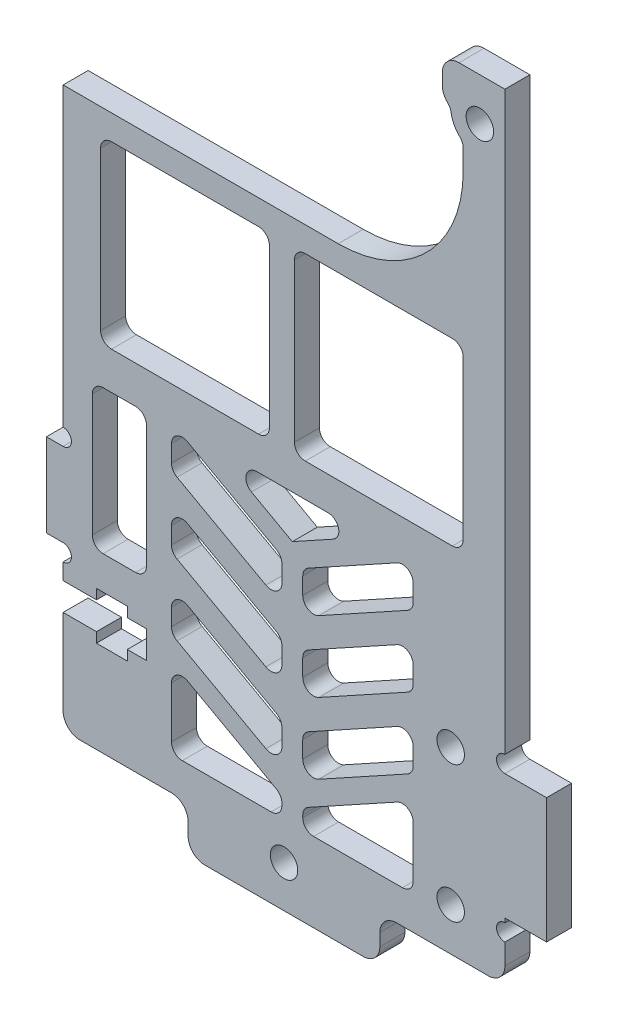
from build123d import *

# Parameters (mm, degrees)
SKETCH_1_W           = 53
SKETCH_1_H           = 150
EXTRUDE_1_DEPTH      = 3
SKETCH_11_R          = 1.65
CUT_EXTRUDE_6_DEPTH  = 10
SKETCH_12_R          = 1.65
CUT_EXTRUDE_7_DEPTH  = 10
SKETCH_13_R          = 1.65
CUT_EXTRUDE_8_DEPTH  = 10
SKETCH_14_W          = 53
SKETCH_14_H          = 15
EXTRUDE_2_DEPTH      = 3
CUT_EXTRUDE_9_DEPTH  = 10
SKETCH_22_W          = 6
SKETCH_22_H          = 35.885928423
CUT_EXTRUDE_10_DEPTH = 10
SKETCH_23_W          = 10
SKETCH_23_H          = 15
EXTRUDE_3_DEPTH      = 3
SKETCH_25_R          = 1.65
CUT_EXTRUDE_12_DEPTH = 10
SKETCH_26_W          = 4
SKETCH_26_H          = 10
EXTRUDE_4_DEPTH      = 3
SKETCH_27_R          = 1
CUT_EXTRUDE_13_DEPTH = 10
SKETCH_28_W          = 3.3
SKETCH_28_H          = 3.3
CUT_EXTRUDE_14_DEPTH = 10
SKETCH_29_W          = 3.7
SKETCH_29_H          = 5.7
CUT_EXTRUDE_15_DEPTH = 10
SKETCH_30_W          = 13.25
SKETCH_30_H          = 22.6
SKETCH_30_W_2        = 20.25
SKETCH_30_H_2        = 21.557035789
SKETCH_30_H_3        = 21.557035788
SKETCH_30_H_4        = 9.4
CUT_EXTRUDE_16_DEPTH = 10
SKETCH_31_W          = 15
SKETCH_31_H          = 5.5
CUT_EXTRUDE_17_DEPTH = 10
SKETCH_32_W          = 6.5
SKETCH_32_H          = 17.25
CUT_EXTRUDE_18_DEPTH = 10
FILLET_1_R           = 1.3
FILLET_2_R           = 2
SKETCH_33_W          = 29.5
SKETCH_33_H          = 35
EXTRUDE_5_DEPTH      = 3
CUT_EXTRUDE_19_DEPTH = 10
SKETCH_35_W          = 2.5
SKETCH_35_H          = 22.689655172
EXTRUDE_6_DEPTH      = 3
FILLET_3_R           = 1.3
SKETCH_37_R          = 1.65
EXTRUDE_7_DEPTH      = 3
FILLET_4_R           = 1.3
SKETCH_38_W          = 6
SKETCH_38_H          = 19.885928423
CUT_EXTRUDE_20_DEPTH = 82.401781307
SKETCH_39_W          = 61
SKETCH_39_H          = 26.057035788
CUT_EXTRUDE_21_DEPTH = 82.401781307
FILLET_6_R           = 2
FILLET_7_R           = 15
SKETCH_40_R          = 1
CUT_EXTRUDE_22_DEPTH = 82.401781307


with BuildPart() as part:
    # 草图1 → 凸台-拉伸1 (new body)
    with BuildSketch(Plane.XY):
        Rectangle(SKETCH_1_W, SKETCH_1_H)
    extrude(amount=EXTRUDE_1_DEPTH)

    # 草图11 → 切除-拉伸6 (cut)
    with BuildSketch(Plane.XY.offset(3)):
        with Locations((0, -70)):
            Circle(SKETCH_11_R)
    extrude(amount=-CUT_EXTRUDE_6_DEPTH, mode=Mode.SUBTRACT)

    # 草图12 → 切除-拉伸7 (cut)
    with BuildSketch(Plane.XY.offset(3)):
        with Locations((-23.5, 54.5)):
            Circle(SKETCH_12_R)
        with Locations((-23.5, 34.5)):
            Circle(SKETCH_12_R)
    extrude(amount=-CUT_EXTRUDE_7_DEPTH, mode=Mode.SUBTRACT)

    # 草图13 → 切除-拉伸8 (cut)
    with BuildSketch(Plane(origin=(0, 0, 0), x_dir=(-1, 0, 0), z_dir=(0, 0, -1))):
        with Locations((-23.5, 18.5)):
            Circle(SKETCH_13_R)
        with Locations((-23.5, 38.5)):
            Circle(SKETCH_13_R)
    extrude(amount=-CUT_EXTRUDE_8_DEPTH, mode=Mode.SUBTRACT)

    # 草图14 → 凸台-拉伸2 (add)
    with BuildSketch(Plane(origin=(0, 0, 0), x_dir=(-1, 0, 0), z_dir=(0, 0, -1))):
        with Locations((0, 82.5)):
            Rectangle(SKETCH_14_W, SKETCH_14_H)
    extrude(amount=-EXTRUDE_2_DEPTH)

    # 草图21 → 切除-拉伸9 (cut)
    with BuildSketch(Plane(origin=(0, 0, 0), x_dir=(-1, 0, 0), z_dir=(0, 0, -1))):
        Polygon((-26.5, 43.5), (-20.5, 43.5), (-20.5, 23.614071577), (20.5, 23.614071577), (20.5, 59.5), (26.5, 59.5), (26.5, 90), (-26.5, 90), align=None)
    extrude(amount=-CUT_EXTRUDE_9_DEPTH, mode=Mode.SUBTRACT)

    # 草图22 → 切除-拉伸10 (cut)
    with BuildSketch(Plane(origin=(0, 0, 0), x_dir=(-1, 0, 0), z_dir=(0, 0, -1))):
        with Locations((23.5, 41.557035789)):
            Rectangle(SKETCH_22_W, SKETCH_22_H)
    extrude(amount=-CUT_EXTRUDE_10_DEPTH, mode=Mode.SUBTRACT)

    # 草图23 → 凸台-拉伸3 (add)
    with BuildSketch(Plane(origin=(0, 0, 0), x_dir=(-1, 0, 0), z_dir=(0, 0, -1))):
        with Locations((-26.5, -55)):
            Rectangle(SKETCH_23_W, SKETCH_23_H)
    extrude(amount=-EXTRUDE_3_DEPTH)

    # 草图25 → 切除-拉伸12 (cut)
    with BuildSketch(Plane(origin=(0, 0, 0), x_dir=(-1, 0, 0), z_dir=(0, 0, -1))):
        with Locations((-20, -48)):
            Circle(SKETCH_25_R)
        with Locations((-20, -64.364049227)):
            Circle(SKETCH_25_R)
    extrude(amount=-CUT_EXTRUDE_12_DEPTH, mode=Mode.SUBTRACT)

    # 草图26 → 凸台-拉伸4 (add)
    with BuildSketch(Plane.XY.offset(3)):
        with Locations((-26.5, -45)):
            Rectangle(SKETCH_26_W, SKETCH_26_H)
    extrude(amount=-EXTRUDE_4_DEPTH)

    # 草图27 → 切除-拉伸13 (cut)
    with BuildSketch(Plane.XY.offset(3)):
        with Locations((-26.5, -39)):
            Circle(SKETCH_27_R)
        with Locations((-26.5, -51)):
            Circle(SKETCH_27_R)
    extrude(amount=-CUT_EXTRUDE_13_DEPTH, mode=Mode.SUBTRACT)

    # 草图28 → 切除-拉伸14 (cut)
    with BuildSketch(Plane.ZY.offset(26.5)):
        with Locations((1.5173157, -55.6)):
            Rectangle(SKETCH_28_W, SKETCH_28_H)
    extrude(amount=-CUT_EXTRUDE_14_DEPTH, mode=Mode.SUBTRACT)

    # 草图29 → 切除-拉伸15 (cut)
    with BuildSketch(Plane(origin=(0, 0, 0), x_dir=(-1, 0, 0), z_dir=(0, 0, -1))):
        with Locations((20.65, -55.6)):
            Rectangle(SKETCH_29_W, SKETCH_29_H)
    extrude(amount=-CUT_EXTRUDE_15_DEPTH, mode=Mode.SUBTRACT)

    # 草图30 → 切除-拉伸16 (cut)
    with BuildSketch(Plane(origin=(0, 0, 0), x_dir=(-1, 0, 0), z_dir=(0, 0, -1))):
        with Locations((6.375, -42.8)):
            Rectangle(SKETCH_30_W, SKETCH_30_H)
        with Locations((-9.875, -42.8)):
            Rectangle(SKETCH_30_W, SKETCH_30_H)
        with Locations((-11.375, -16.221482106)):
            Rectangle(SKETCH_30_W_2, SKETCH_30_H_2)
        with Locations((-11.375, 8.335553683)):
            Rectangle(SKETCH_30_W_2, SKETCH_30_H_3)
        with Locations((11.875, 8.335553683)):
            Rectangle(SKETCH_30_W_2, SKETCH_30_H_3)
        with Locations((11.875, -16.221482106)):
            Rectangle(SKETCH_30_W_2, SKETCH_30_H_2)
        with Locations((-9.875, -61.8)):
            Rectangle(SKETCH_30_W, SKETCH_30_H_4)
        with Locations((6.375, -61.8)):
            Rectangle(SKETCH_30_W, SKETCH_30_H_4)
    extrude(amount=-CUT_EXTRUDE_16_DEPTH, mode=Mode.SUBTRACT)

    # 草图31 → 切除-拉伸17 (cut)
    with BuildSketch(Plane(origin=(0, 0, 0), x_dir=(-1, 0, 0), z_dir=(0, 0, -1))):
        with Locations((-19, -72.25)):
            Rectangle(SKETCH_31_W, SKETCH_31_H)
        with Locations((19, -72.25)):
            Rectangle(SKETCH_31_W, SKETCH_31_H)
    extrude(amount=-CUT_EXTRUDE_17_DEPTH, mode=Mode.SUBTRACT)

    # 草图32 → 切除-拉伸18 (cut)
    with BuildSketch(Plane(origin=(0, 0, 0), x_dir=(-1, 0, 0), z_dir=(0, 0, -1))):
        with Locations((19.75, -40.125)):
            Rectangle(SKETCH_32_W, SKETCH_32_H)
    extrude(amount=-CUT_EXTRUDE_18_DEPTH, mode=Mode.SUBTRACT)

    # 圆角1
    fillet_1_edges = [part.edges().sort_by_distance(p)[0] for p in [
        (3.25, -54.1, 1.5),
        (16.5, -54.1, 1.5),
        (16.5, -31.5, 1.5),
        (3.25, -31.5, 1.5),
        (21.5, -5.442964211, 1.5),
        (1.25, -5.442964211, 1.5),
        (1.25, -27, 1.5),
        (21.5, -27, 1.5),
        (1.25, 19.114071577, 1.5),
        (1.25, -2.442964211, 1.5),
        (-1.75, -2.442964211, 1.5),
        (-1.75, 19.114071577, 1.5),
        (-22, 19.114071577, 1.5),
        (-22, -2.442964211, 1.5),
        (-13, -57.1, 1.5),
        (-13, -66.5, 1.5),
        (0.25, -66.5, 1.5),
        (0.25, -57.1, 1.5),
        (3.25, -57.1, 1.5),
        (3.25, -66.5, 1.5),
        (16.5, -66.5, 1.5),
        (16.5, -57.1, 1.5),
        (-1.75, -5.442964211, 1.5),
        (-22, -5.442964211, 1.5),
        (-22, -27, 1.5),
        (-1.75, -27, 1.5),
        (-13, -54.1, 1.5),
        (0.25, -54.1, 1.5),
        (0.25, -31.5, 1.5),
        (-13, -31.5, 1.5),
        (-16.5, -48.75, 1.5),
        (-16.5, -31.5, 1.5),
        (-23, -31.5, 1.5),
        (-23, -48.75, 1.5),
    ]]
    fillet(fillet_1_edges, radius=FILLET_1_R)

    # 圆角2
    fillet_2_edges = [part.edges().sort_by_distance(p)[0] for p in [
        (-26.5, 23.614071577, 1.5),
        (-11.5, -75, 1.5),
        (11.5, -75, 1.5),
        (26.5, -69.5, 1.5),
        (11.5, -69.5, 1.5),
        (-11.5, -69.5, 1.5),
        (-26.5, -69.5, 1.5),
    ]]
    fillet(fillet_2_edges, radius=FILLET_2_R)

    # 草图33 → 凸台-拉伸5 (add)
    with BuildSketch(Plane(origin=(0, 0, 0), x_dir=(-1, 0, 0), z_dir=(0, 0, -1))):
        with Locations((-1.75, -49)):
            Rectangle(SKETCH_33_W, SKETCH_33_H)
    extrude(amount=-EXTRUDE_5_DEPTH)

    # 草图34 → 切除-拉伸19 (cut)
    with BuildSketch(Plane(origin=(0, 0, 0), x_dir=(-1, 0, 0), z_dir=(0, 0, -1))):
        Polygon((-15.5, -31), (-1, -39), (13.5, -31), (13.5, -36), (-1, -44), (-15.5, -36), align=None)
        Polygon((-15.5, -44.5), (-15.5, -39.5), (-1, -47.5), (13.5, -39.5), (13.5, -44.5), (-1, -52.5), align=None)
        Polygon((-15.5, -53), (-15.5, -48), (-1, -56), (13.5, -48), (13.5, -53), (-1, -61), align=None)
        Polygon((-2.25, -65.5), (-2.25, -63.165602614), (-15.5, -55.855257786), (-15.5, -65.5), align=None)
        Polygon((13.5, -55.855257786), (13.5, -65.5), (0.25, -65.5), (0.25, -63.165602614), align=None)
        Polygon((8.324845262, -31), (-1, -36.144742214), (-10.324845262, -31), align=None)
    extrude(amount=-CUT_EXTRUDE_19_DEPTH, mode=Mode.SUBTRACT)

    # 草图35 → 凸台-拉伸6 (add)
    with BuildSketch(Plane(origin=(0, 0, 0), x_dir=(-1, 0, 0), z_dir=(0, 0, -1))):
        with Locations((-1, -49.655172414)):
            Rectangle(SKETCH_35_W, SKETCH_35_H)
    extrude(amount=-EXTRUDE_6_DEPTH)

    # 圆角3
    fillet_3_edges = [part.edges().sort_by_distance(p)[0] for p in [
        (2.25, -60.310344828, 1.5),
        (-0.25, -60.310344828, 1.5),
        (-0.25, -38.310344828, 1.5),
        (-0.25, -43.310344828, 1.5),
        (-0.25, -46.810344828, 1.5),
        (-0.25, -51.810344828, 1.5),
        (-0.25, -55.310344828, 1.5),
        (2.25, -43.310344828, 1.5),
        (2.25, -46.810344828, 1.5),
        (2.25, -51.810344828, 1.5),
        (2.25, -55.310344828, 1.5),
        (2.25, -38.310344828, 1.5),
        (10.324845262, -31, 1.5),
        (-8.324845262, -31, 1.5),
        (2.25, -65.5, 1.5),
        (15.5, -65.5, 1.5),
        (15.5, -55.855257786, 1.5),
        (2.25, -63.165602614, 1.5),
        (-13.5, -65.5, 1.5),
        (-0.25, -65.5, 1.5),
        (-0.25, -63.165602614, 1.5),
        (-13.5, -55.855257786, 1.5),
        (15.5, -48, 1.5),
        (-13.5, -48, 1.5),
        (-13.5, -53, 1.5),
        (15.5, -53, 1.5),
        (15.5, -39.5, 1.5),
        (-13.5, -39.5, 1.5),
        (-13.5, -44.5, 1.5),
        (15.5, -44.5, 1.5),
        (15.5, -36, 1.5),
        (15.5, -31, 1.5),
        (-13.5, -31, 1.5),
        (-13.5, -36, 1.5),
    ]]
    fillet(fillet_3_edges, radius=FILLET_3_R)

    # 草图37 → 凸台-拉伸7 (add)
    with BuildSketch(Plane(origin=(0, 0, 0), x_dir=(-1, 0, 0), z_dir=(0, 0, -1))):
        with BuildLine():
            ThreePointArc((-26.5, 16.697224362), (-20, 18.5), (-26.5, 20.302775638))
            Line((-26.5, 20.302775638), (-26.5, 16.697224362))
        make_face()
        with Locations((-23.5, 18.5)):
            Circle(SKETCH_37_R, mode=Mode.SUBTRACT)
    extrude(amount=-EXTRUDE_7_DEPTH)

    # 圆角4
    fillet_4_edges = [part.edges().sort_by_distance(p)[0] for p in [
        (20.054290189, 19.114071577, 1.5),
        (21.5, 15.627718677, 1.5),
    ]]
    fillet(fillet_4_edges, radius=FILLET_4_R)

    # 草图38 → 切除-拉伸20 (cut, through all)
    with BuildSketch(Plane(origin=(0, 0, 0), x_dir=(-1, 0, 0), z_dir=(0, 0, -1))):
        with Locations((-23.5, 33.557035789)):
            Rectangle(SKETCH_38_W, SKETCH_38_H)
    extrude(amount=-CUT_EXTRUDE_20_DEPTH, mode=Mode.SUBTRACT)

    # 草图39 → 切除-拉伸21 (cut, through all)
    with BuildSketch(Plane(origin=(0, 0, 0), x_dir=(-1, 0, 0), z_dir=(0, 0, -1))):
        with Locations((11.5, 10.585553683)):
            Rectangle(SKETCH_39_W, SKETCH_39_H)
    extrude(amount=-CUT_EXTRUDE_21_DEPTH, mode=Mode.SUBTRACT)

    # 圆角6
    fillet_6_edges = [part.edges().sort_by_distance(p)[0] for p in [
        (19, 19.089662008, 1.5),
        (19, 23.614071577, 1.5),
    ]]
    fillet(fillet_6_edges, radius=FILLET_6_R)

    # 圆角7
    fillet_7_edges = [part.edges().sort_by_distance(p)[0] for p in [
        (21.5, -2.442964211, 1.5),
    ]]
    fillet(fillet_7_edges, radius=FILLET_7_R)

    # 草图40 → 切除-拉伸22 (cut, through all)
    with BuildSketch(Plane(origin=(0, 0, 0), x_dir=(-1, 0, 0), z_dir=(0, 0, -1))):
        with Locations((-26.5, -46.5)):
            Circle(SKETCH_40_R)
        with Locations((-26.5, -63.996076211)):
            Circle(SKETCH_40_R)
    extrude(amount=-CUT_EXTRUDE_22_DEPTH, mode=Mode.SUBTRACT)


solid = part.part
